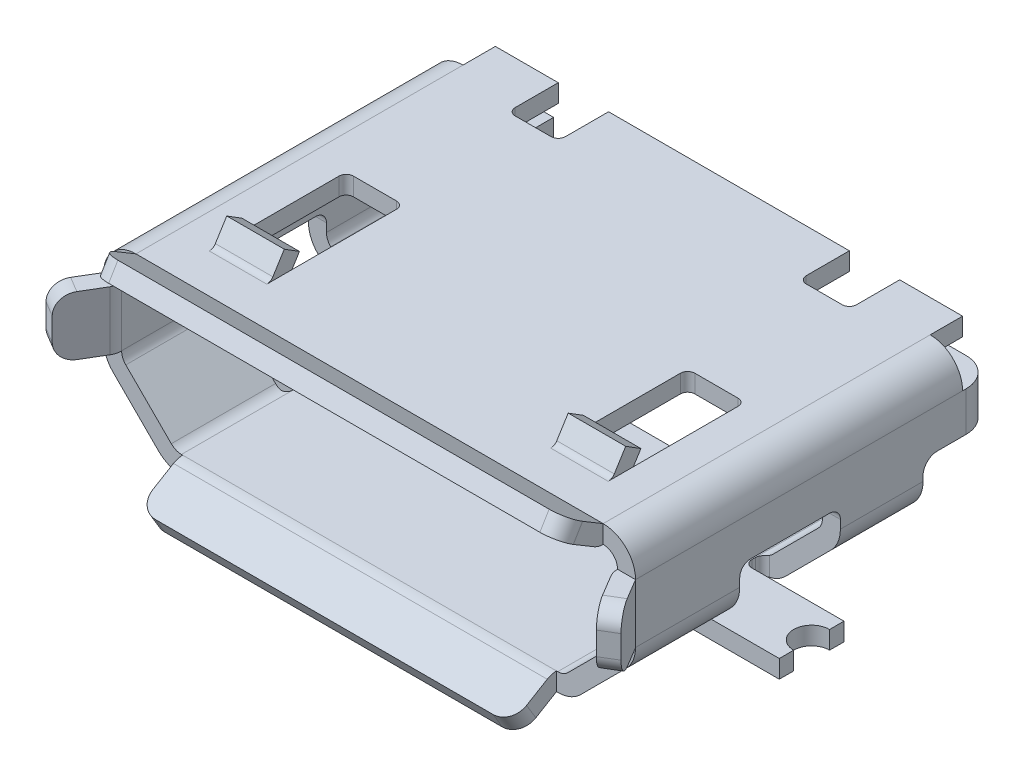
from build123d import *

# Parameters (mm, degrees)
EXTRUDE_THIN1_DEPTH     = 5
BOSS_EXTRUDE1_DEPTH     = 0.82
BOSS_EXTRUDE2_DEPTH     = 2.6
BOSS_EXTRUDE3_DEPTH     = 3.25
FILLET1_R               = 0.25
CUT_EXTRUDE1_DEPTH      = 1.1
CUT_EXTRUDE1_DEPTH_BACK = 7.838128399
FILLET2_R               = 0.15
BOSS_EXTRUDE4_DEPTH     = 0.25
FILLET3_R               = 0.1
CUT_EXTRUDE2_DEPTH      = 0.25
BOSS_EXTRUDE5_DEPTH     = 0.8
FILLET4_R               = 0.1
CUT_EXTRUDE3_DEPTH      = 7.838128472
CUT_EXTRUDE3_DEPTH_BACK = 7.838128472
CUT_EXTRUDE4_DEPTH      = 7.929826838
CUT_EXTRUDE4_DEPTH_BACK = 7.929826838
SKETCH11_W              = 0.45
SKETCH11_H              = 0.45
CUT_EXTRUDE5_DEPTH      = 0.8
FILLET5_R               = 0.1
CUT_EXTRUDE6_DEPTH      = 0.8
BOSS_EXTRUDE6_DEPTH     = 0.55


with BuildPart() as part:
    # Sketch1 → Extrude-Thin1 (new body)
    with BuildSketch(Plane.XY):
        with BuildLine():
            Line((3.25, 2.1), (-3.25, 2.1))
            ThreePointArc((-3.25, 2.1), (-3.568198052, 1.968198052), (-3.7, 1.65))
            Line((-3.7, 1.65), (-3.7, 0.832842712))
            ThreePointArc((-3.7, 0.832842712), (-3.66574579, 0.660635168), (-3.568198052, 0.514644661))
            Line((-3.568198052, 0.514644661), (-2.935355339, -0.118198052))
            ThreePointArc((-2.935355339, -0.118198052), (-2.789364832, -0.21574579), (-2.617157288, -0.25))
            Line((-2.617157288, -0.25), (0, -0.25))
            Line((0, -0.25), (2.617157288, -0.25))
            ThreePointArc((2.617157288, -0.25), (2.789364832, -0.21574579), (2.935355339, -0.118198052))
            Line((2.935355339, -0.118198052), (3.568198052, 0.514644661))
            ThreePointArc((3.568198052, 0.514644661), (3.66574579, 0.660635168), (3.7, 0.832842712))
            Line((3.7, 0.832842712), (3.7, 1.65))
            ThreePointArc((3.7, 1.65), (3.568198052, 1.968198052), (3.25, 2.1))
        make_face()
        with BuildLine():
            Line((3.25, 1.85), (-3.25, 1.85))
            ThreePointArc((-3.25, 1.85), (-3.391421356, 1.791421356), (-3.45, 1.65))
            Line((-3.45, 1.65), (-3.45, 0.832842712))
            ThreePointArc((-3.45, 0.832842712), (-3.434775907, 0.756306026), (-3.391421356, 0.691421356))
            Line((-3.391421356, 0.691421356), (-2.758578644, 0.058578644))
            ThreePointArc((-2.758578644, 0.058578644), (-2.693693974, 0.015224093), (-2.617157288, 0))
            Line((-2.617157288, 0), (0, 0))
            Line((0, 0), (2.617157288, 0))
            ThreePointArc((2.617157288, 0), (2.693693974, 0.015224093), (2.758578644, 0.058578644))
            Line((2.758578644, 0.058578644), (3.391421356, 0.691421356))
            ThreePointArc((3.391421356, 0.691421356), (3.434775907, 0.756306026), (3.45, 0.832842712))
            Line((3.45, 0.832842712), (3.45, 1.65))
            ThreePointArc((3.45, 1.65), (3.391421356, 1.791421356), (3.25, 1.85))
        make_face(mode=Mode.SUBTRACT)
    extrude(amount=-EXTRUDE_THIN1_DEPTH)

    # Sketch2 → Boss-Extrude1 (add)
    with BuildSketch(Plane(origin=(0, 1.65, 0), x_dir=(1, 0, 0), z_dir=(0, 1, 0))):
        with BuildLine():
            Line((-3.7, 0), (-4, -0.501696258))
            Line((-4, -0.501696258), (-3.785434976, -0.63))
            Line((-3.785434976, -0.63), (-3.485434976, -0.128303742))
            ThreePointArc((-3.485434976, -0.128303742), (-3.45902152, -0.066553527), (-3.45, 0))
            Line((-3.45, 0), (-3.7, 0))
        make_face()
        with BuildLine():
            Line((3.7, 0), (4, -0.501696258))
            Line((4, -0.501696258), (3.785434976, -0.63))
            Line((3.785434976, -0.63), (3.485434976, -0.128303742))
            ThreePointArc((3.485434976, -0.128303742), (3.45902152, -0.066553527), (3.45, 0))
            Line((3.45, 0), (3.7, 0))
        make_face()
    extrude(amount=-BOSS_EXTRUDE1_DEPTH)

    # Sketch4 → Boss-Extrude2 (add, symmetric)
    with BuildSketch(Plane(origin=(0, 0, 0), x_dir=(0, 0, -1), z_dir=(1, 0, 0))):
        with BuildLine():
            Line((0, -0.25), (-0.501696258, -0.55))
            Line((-0.501696258, -0.55), (-0.63, -0.335434976))
            Line((-0.63, -0.335434976), (-0.128303742, -0.035434976))
            ThreePointArc((-0.128303742, -0.035434976), (-0.066553527, -0.00902152), (0, 0))
            Line((0, 0), (0, -0.25))
        make_face()
    extrude(amount=BOSS_EXTRUDE2_DEPTH, both=True)

    # Sketch3 → Boss-Extrude3 (add, symmetric)
    with BuildSketch(Plane(origin=(0, 0, 0), x_dir=(0, 0, -1), z_dir=(1, 0, 0))):
        with BuildLine():
            Line((0, 2.1), (-0.501696258, 2.4))
            Line((-0.501696258, 2.4), (-0.63, 2.185434976))
            Line((-0.63, 2.185434976), (-0.128303742, 1.885434976))
            ThreePointArc((-0.128303742, 1.885434976), (-0.066553527, 1.85902152), (0, 1.85))
            Line((0, 1.85), (0, 2.1))
        make_face()
    extrude(amount=BOSS_EXTRUDE3_DEPTH, both=True)

    # Fillet1
    fillet1_edges = [part.edges().sort_by_distance(p)[0] for p in [
        (3.892717488, 0.83, 0.565848129),
        (3.892717488, 1.65, 0.565848129),
        (-3.892717488, 0.83, 0.565848129),
        (-3.892717488, 1.65, 0.565848129),
        (-2.6, -0.442717488, 0.565848129),
        (2.6, -0.442717488, 0.565848129),
        (3.25, 2.292717488, 0.565848129),
        (-3.25, 2.292717488, 0.565848129),
    ]]
    fillet(fillet1_edges, radius=FILLET1_R)

    # Sketch5 → Cut-Extrude1 (cut, two sides: drawn at the far end of the back side and taken through both)
    with BuildSketch(Plane(origin=(0, 0, 0), x_dir=(1, 0, 0), z_dir=(0, 1, 0)).offset(-CUT_EXTRUDE1_DEPTH_BACK)):
        with BuildLine():
            Line((2.717157288, 1.45), (3.7, 1.45))
            Line((3.7, 1.45), (3.7, 2.85))
            Line((3.7, 2.85), (2.717157288, 2.85))
            ThreePointArc((2.717157288, 2.85), (2.646446609, 2.820710678), (2.617157288, 2.75))
            Line((2.617157288, 2.75), (2.617157288, 1.55))
            ThreePointArc((2.617157288, 1.55), (2.646446609, 1.479289322), (2.717157288, 1.45))
        make_face()
        with BuildLine():
            Line((-3.7, 2.85), (-2.717157288, 2.85))
            ThreePointArc((-2.717157288, 2.85), (-2.646446609, 2.820710678), (-2.617157288, 2.75))
            Line((-2.617157288, 2.75), (-2.617157288, 1.55))
            ThreePointArc((-2.617157288, 1.55), (-2.646446609, 1.479289322), (-2.717157288, 1.45))
            Line((-2.717157288, 1.45), (-3.7, 1.45))
            Line((-3.7, 1.45), (-3.7, 2.85))
        make_face()
    extrude(amount=CUT_EXTRUDE1_DEPTH + CUT_EXTRUDE1_DEPTH_BACK, mode=Mode.SUBTRACT)

    # Fillet2
    fillet2_edges = [part.edges().sort_by_distance(p)[0] for p in [
        (3.575, 1.1, -2.85),
        (3.575, 1.1, -1.45),
        (-3.575, 1.1, -2.85),
        (-3.575, 1.1, -1.45),
    ]]
    fillet(fillet2_edges, radius=FILLET2_R)

    # Sketch6 → Boss-Extrude4 (add)
    with BuildSketch(Plane.XZ.offset(0.25)):
        with BuildLine():
            Line((-4, -1.7), (4, -1.7))
            Line((4, -1.7), (4, -1.9))
            ThreePointArc((4, -1.9), (3.75, -2.15), (4, -2.4))
            Line((4, -2.4), (4, -2.6))
            Line((4, -2.6), (-4, -2.6))
            Line((-4, -2.6), (-4, -2.4))
            ThreePointArc((-4, -2.4), (-3.75, -2.15), (-4, -1.9))
            Line((-4, -1.9), (-4, -1.7))
        make_face()
    extrude(amount=-BOSS_EXTRUDE4_DEPTH)

    # Fillet3
    fillet3_edges = [part.edges().sort_by_distance(p)[0] for p in [
        (-2.617157288, -0.125, -2.6),
        (-2.617157288, -0.125, -1.7),
        (2.617157288, -0.125, -1.7),
        (2.617157288, -0.125, -2.6),
    ]]
    fillet(fillet3_edges, radius=FILLET3_R)

    # Sketch7 → Cut-Extrude2 (cut)
    with BuildSketch(Plane(origin=(0, 2.1, 0), x_dir=(1, 0, 0), z_dir=(0, 1, 0))):
        with BuildLine():
            Line((-2.675, 2.45), (-2.075, 2.45))
            ThreePointArc((-2.075, 2.45), (-2.004289322, 2.420710678), (-1.975, 2.35))
            Line((-1.975, 2.35), (-1.975, 0.6))
            Line((-1.975, 0.6), (-2.775, 0.6))
            Line((-2.775, 0.6), (-2.775, 2.35))
            ThreePointArc((-2.775, 2.35), (-2.745710678, 2.420710678), (-2.675, 2.45))
        make_face()
        with BuildLine():
            Line((2.075, 2.45), (2.675, 2.45))
            ThreePointArc((2.675, 2.45), (2.745710678, 2.420710678), (2.775, 2.35))
            Line((2.775, 2.35), (2.775, 0.6))
            Line((2.775, 0.6), (1.975, 0.6))
            Line((1.975, 0.6), (1.975, 2.35))
            ThreePointArc((1.975, 2.35), (2.004289322, 2.420710678), (2.075, 2.45))
        make_face()
    extrude(amount=-CUT_EXTRUDE2_DEPTH, mode=Mode.SUBTRACT)

    # Sketch9 → Boss-Extrude5 (add)
    with BuildSketch(Plane.ZY.offset(1.975)):
        with BuildLine():
            Line((-0.6, 2.1), (-0.788233436, 2.4))
            Line((-0.788233436, 2.4), (-1, 2.267128173))
            Line((-1, 2.267128173), (-0.811766564, 1.967128173))
            ThreePointArc((-0.811766564, 1.967128173), (-0.72100009, 1.88123305), (-0.6, 1.85))
            Line((-0.6, 1.85), (-0.6, 2.1))
        make_face()
    boss_extrude5 = extrude(amount=BOSS_EXTRUDE5_DEPTH)

    # Mirror1: Boss-Extrude5 across plane
    add(boss_extrude5.mirror(Plane(origin=(0, 0, 0), x_dir=(0, 0, 1), z_dir=(1, 0, 0))))

    # Fillet4
    fillet4_edges = [part.edges().sort_by_distance(p)[0] for p in [
        (-2.375, 2.1, -0.6),
        (2.375, 2.1, -0.6),
    ]]
    fillet(fillet4_edges, radius=FILLET4_R)

    # Sketch10 → Cut-Extrude3 (cut, two sides: drawn at the far end of the back side and taken through both)
    with BuildSketch(Plane(origin=(0, 0, 0), x_dir=(0, 0, -1), z_dir=(1, 0, 0)).offset(-CUT_EXTRUDE3_DEPTH_BACK)):
        with BuildLine():
            Line((4, -0.25), (5, -0.25))
            Line((5, -0.25), (5, 1.1))
            Line((5, 1.1), (4.2, 1.1))
            ThreePointArc((4.2, 1.1), (4.058578644, 1.041421356), (4, 0.9))
            Line((4, 0.9), (4, -0.25))
        make_face()
    extrude(amount=CUT_EXTRUDE3_DEPTH + CUT_EXTRUDE3_DEPTH_BACK, mode=Mode.SUBTRACT)

    # Sketch11 → Cut-Extrude4 (cut, two sides: drawn at the far end of the back side and taken through both)
    with BuildSketch(Plane(origin=(0, 2.1, 0), x_dir=(1, 0, 0), z_dir=(0, 1, 0)).offset(-CUT_EXTRUDE4_DEPTH_BACK)):
        with Locations((-3.475, 4.775)):
            Rectangle(SKETCH11_W, SKETCH11_H)
        with Locations((3.475, 4.775)):
            Rectangle(SKETCH11_W, SKETCH11_H)
    extrude(amount=CUT_EXTRUDE4_DEPTH + CUT_EXTRUDE4_DEPTH_BACK, mode=Mode.SUBTRACT)

    # Sketch12 → Cut-Extrude5 (cut)
    with BuildSketch(Plane.XZ.offset(0.25)):
        with BuildLine():
            Line((-2.05, -3.5), (2.05, -3.5))
            ThreePointArc((2.05, -3.5), (2.191421356, -3.558578644), (2.25, -3.7))
            Line((2.25, -3.7), (2.25, -4))
            Line((2.25, -4), (-2.25, -4))
            Line((-2.25, -4), (-2.25, -3.7))
            ThreePointArc((-2.25, -3.7), (-2.191421356, -3.558578644), (-2.05, -3.5))
        make_face()
    extrude(amount=-CUT_EXTRUDE5_DEPTH, mode=Mode.SUBTRACT)

    # Fillet5
    fillet5_edges = [part.edges().sort_by_distance(p)[0] for p in [
        (-2.25, -0.125, -4),
        (2.25, -0.125, -4),
    ]]
    fillet(fillet5_edges, radius=FILLET5_R)

    # Sketch13 → Cut-Extrude6 (cut)
    with BuildSketch(Plane(origin=(0, 2.1, 0), x_dir=(1, 0, 0), z_dir=(0, 1, 0))):
        with BuildLine():
            Line((-2.375, 5), (-1.675, 5))
            Line((-1.675, 5), (-1.675, 4.4))
            ThreePointArc((-1.675, 4.4), (-1.704289322, 4.329289322), (-1.775, 4.3))
            Line((-1.775, 4.3), (-2.275, 4.3))
            ThreePointArc((-2.275, 4.3), (-2.345710678, 4.329289322), (-2.375, 4.4))
            Line((-2.375, 4.4), (-2.375, 5))
        make_face()
        with BuildLine():
            Line((1.675, 5), (2.375, 5))
            Line((2.375, 5), (2.375, 4.4))
            ThreePointArc((2.375, 4.4), (2.345710678, 4.329289322), (2.275, 4.3))
            Line((2.275, 4.3), (1.775, 4.3))
            ThreePointArc((1.775, 4.3), (1.704289322, 4.329289322), (1.675, 4.4))
            Line((1.675, 4.4), (1.675, 5))
        make_face()
    extrude(amount=-CUT_EXTRUDE6_DEPTH, mode=Mode.SUBTRACT)

    # Sketch14 → Boss-Extrude6 (add)
    with BuildSketch(Plane(origin=(0, 1.65, 0), x_dir=(1, 0, 0), z_dir=(0, 1, 0))):
        with BuildLine():
            Line((-3.7, 4.55), (-3.7, 4.6))
            ThreePointArc((-3.7, 4.6), (-3.582842712, 4.882842712), (-3.3, 5))
            Line((-3.3, 5), (-2.44, 5))
            Line((-2.44, 5), (-2.44, 4.75))
            Line((-2.44, 4.75), (-3.3, 4.75))
            ThreePointArc((-3.3, 4.75), (-3.406066017, 4.706066017), (-3.45, 4.6))
            Line((-3.45, 4.6), (-3.45, 4.55))
            Line((-3.45, 4.55), (-3.7, 4.55))
        make_face()
    boss_extrude6 = extrude(amount=-BOSS_EXTRUDE6_DEPTH)

    # Mirror2: Boss-Extrude6 across plane
    add(boss_extrude6.mirror(Plane(origin=(0, 0, 0), x_dir=(0, 0, 1), z_dir=(1, 0, 0))))


solid = part.part
